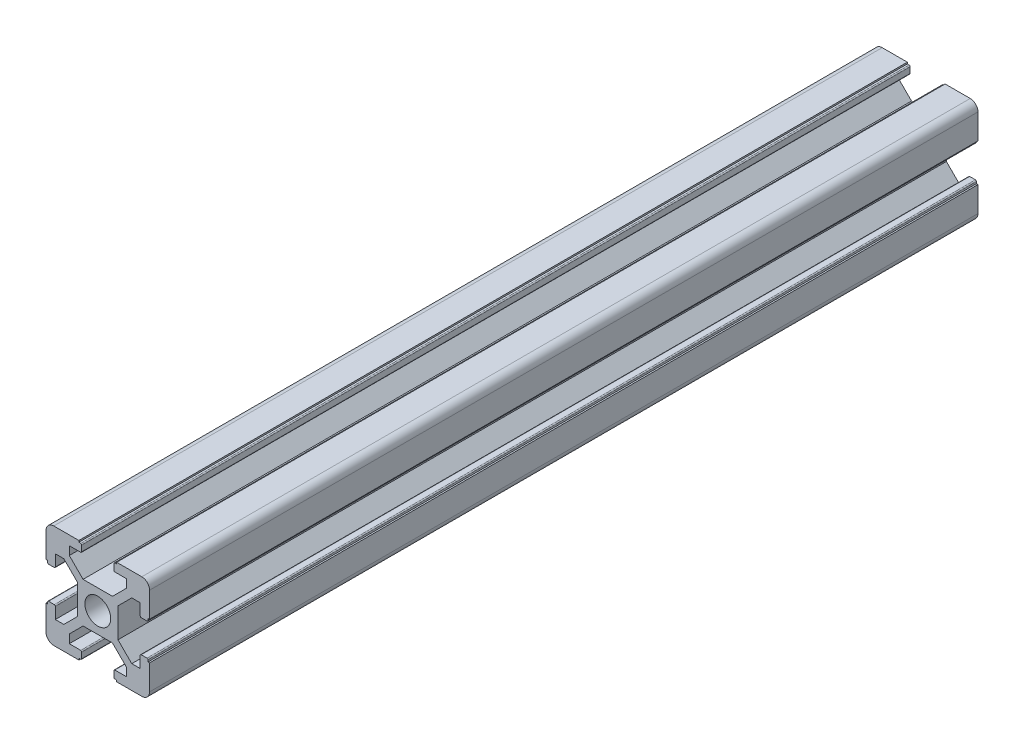
from build123d import *

# Parameters (mm, degrees)
SKETCH_1_R      = 2.5
EXTRUDE_2_DEPTH = 160
EXTRUDE_3_DEPTH = 160


with BuildPart() as part:
    # 草图1 → 凸台-拉伸2 (new body)
    with BuildSketch(Plane.XY):
        with BuildLine():
            Line((3.65, 10), (8.5, 10))
            ThreePointArc((8.5, 10), (9.560660172, 9.560660172), (10, 8.5))
            Line((10, 8.5), (10, 3.65))
            Line((10, 3.65), (8.2, 3.65))
            Line((8.2, 3.65), (8.2, 5.5))
            Line((8.2, 5.5), (6.560660172, 5.5))
            Line((6.560660172, 5.5), (3.9, 2.839339828))
            Line((3.9, 2.839339828), (3.9, -2.839339828))
            Line((3.9, -2.839339828), (6.560660172, -5.5))
            Line((6.560660172, -5.5), (8.2, -5.5))
            Line((8.2, -5.5), (8.2, -3.65))
            Line((8.2, -3.65), (10, -3.65))
            Line((10, -3.65), (10, -8.5))
            ThreePointArc((10, -8.5), (9.560660172, -9.560660172), (8.5, -10))
            Line((8.5, -10), (3.65, -10))
            Line((3.65, -10), (3.65, -8.2))
            Line((3.65, -8.2), (5.5, -8.2))
            Line((5.5, -8.2), (5.5, -6.560660172))
            Line((5.5, -6.560660172), (2.839339828, -3.9))
            Line((2.839339828, -3.9), (-2.839339828, -3.9))
            Line((-2.839339828, -3.9), (-5.5, -6.560660172))
            Line((-5.5, -6.560660172), (-5.5, -8.2))
            Line((-5.5, -8.2), (-3.65, -8.2))
            Line((-3.65, -8.2), (-3.65, -10))
            Line((-3.65, -10), (-8.5, -10))
            ThreePointArc((-8.5, -10), (-9.560660172, -9.560660172), (-10, -8.5))
            Line((-10, -8.5), (-10, -3.65))
            Line((-10, -3.65), (-8.2, -3.65))
            Line((-8.2, -3.65), (-8.2, -5.5))
            Line((-8.2, -5.5), (-6.560660172, -5.5))
            Line((-6.560660172, -5.5), (-3.9, -2.839339828))
            Line((-3.9, -2.839339828), (-3.9, 2.839339828))
            Line((-3.9, 2.839339828), (-6.560660172, 5.5))
            Line((-6.560660172, 5.5), (-8.2, 5.5))
            Line((-8.2, 5.5), (-8.2, 3.65))
            Line((-8.2, 3.65), (-10, 3.65))
            Line((-10, 3.65), (-10, 8.5))
            ThreePointArc((-10, 8.5), (-9.560660172, 9.560660172), (-8.5, 10))
            Line((-8.5, 10), (-3.65, 10))
            Line((-3.65, 10), (-3.65, 8.2))
            Line((-3.65, 8.2), (-5.5, 8.2))
            Line((-5.5, 8.2), (-5.5, 6.560660172))
            Line((-5.5, 6.560660172), (-2.839339828, 3.9))
            Line((-2.839339828, 3.9), (2.839339828, 3.9))
            Line((2.839339828, 3.9), (5.5, 6.560660172))
            Line((5.5, 6.560660172), (5.5, 8.2))
            Line((5.5, 8.2), (3.65, 8.2))
            Line((3.65, 8.2), (3.65, 10))
        make_face()
        Circle(SKETCH_1_R, mode=Mode.SUBTRACT)
    extrude(amount=EXTRUDE_2_DEPTH)

    # 草图3 → 凸台-拉伸3 (add)
    with BuildSketch(Plane.XY.offset(160)):
        with BuildLine():
            Line((-8.2, 3.65), (-9.7, 3.65))
            Line((-9.7, 3.65), (-9.7, 3.3))
            ThreePointArc((-9.7, 3.3), (-9.641421356, 3.158578644), (-9.5, 3.1))
            Line((-9.5, 3.1), (-8.4, 3.1))
            ThreePointArc((-8.4, 3.1), (-8.258578644, 3.158578644), (-8.2, 3.3))
            Line((-8.2, 3.3), (-8.2, 3.65))
        make_face()
        with BuildLine():
            Line((-3.65, 9.7), (-3.65, 8.2))
            Line((-3.65, 8.2), (-3.3, 8.2))
            ThreePointArc((-3.3, 8.2), (-3.158578644, 8.258578644), (-3.1, 8.4))
            Line((-3.1, 8.4), (-3.1, 9.5))
            ThreePointArc((-3.1, 9.5), (-3.158578644, 9.641421356), (-3.3, 9.7))
            Line((-3.3, 9.7), (-3.65, 9.7))
        make_face()
        with BuildLine():
            Line((3.65, 8.2), (3.65, 9.7))
            Line((3.65, 9.7), (3.3, 9.7))
            ThreePointArc((3.3, 9.7), (3.158578644, 9.641421356), (3.1, 9.5))
            Line((3.1, 9.5), (3.1, 8.4))
            ThreePointArc((3.1, 8.4), (3.158578644, 8.258578644), (3.3, 8.2))
            Line((3.3, 8.2), (3.65, 8.2))
        make_face()
        with BuildLine():
            Line((9.7, 3.65), (8.2, 3.65))
            Line((8.2, 3.65), (8.2, 3.3))
            ThreePointArc((8.2, 3.3), (8.258578644, 3.158578644), (8.4, 3.1))
            Line((8.4, 3.1), (9.5, 3.1))
            ThreePointArc((9.5, 3.1), (9.641421356, 3.158578644), (9.7, 3.3))
            Line((9.7, 3.3), (9.7, 3.65))
        make_face()
        with BuildLine():
            Line((3.65, -9.7), (3.65, -8.2))
            Line((3.65, -8.2), (3.3, -8.2))
            ThreePointArc((3.3, -8.2), (3.158578644, -8.258578644), (3.1, -8.4))
            Line((3.1, -8.4), (3.1, -9.5))
            ThreePointArc((3.1, -9.5), (3.158578644, -9.641421356), (3.3, -9.7))
            Line((3.3, -9.7), (3.65, -9.7))
        make_face()
        with BuildLine():
            Line((-3.65, -8.2), (-3.65, -9.7))
            Line((-3.65, -9.7), (-3.3, -9.7))
            ThreePointArc((-3.3, -9.7), (-3.158578644, -9.641421356), (-3.1, -9.5))
            Line((-3.1, -9.5), (-3.1, -8.4))
            ThreePointArc((-3.1, -8.4), (-3.158578644, -8.258578644), (-3.3, -8.2))
            Line((-3.3, -8.2), (-3.65, -8.2))
        make_face()
        with BuildLine():
            Line((8.2, -3.65), (8.2, -3.3))
            ThreePointArc((8.2, -3.3), (8.258578644, -3.158578644), (8.4, -3.1))
            Line((8.4, -3.1), (9.5, -3.1))
            ThreePointArc((9.5, -3.1), (9.641421356, -3.158578644), (9.7, -3.3))
            Line((9.7, -3.3), (9.7, -3.65))
            Line((9.7, -3.65), (8.2, -3.65))
        make_face()
        with BuildLine():
            Line((-8.2, -3.65), (-8.2, -3.3))
            ThreePointArc((-8.2, -3.3), (-8.258578644, -3.158578644), (-8.4, -3.1))
            Line((-8.4, -3.1), (-9.5, -3.1))
            ThreePointArc((-9.5, -3.1), (-9.641421356, -3.158578644), (-9.7, -3.3))
            Line((-9.7, -3.3), (-9.7, -3.65))
            Line((-9.7, -3.65), (-8.2, -3.65))
        make_face()
    extrude(amount=-EXTRUDE_3_DEPTH)


solid = part.part
